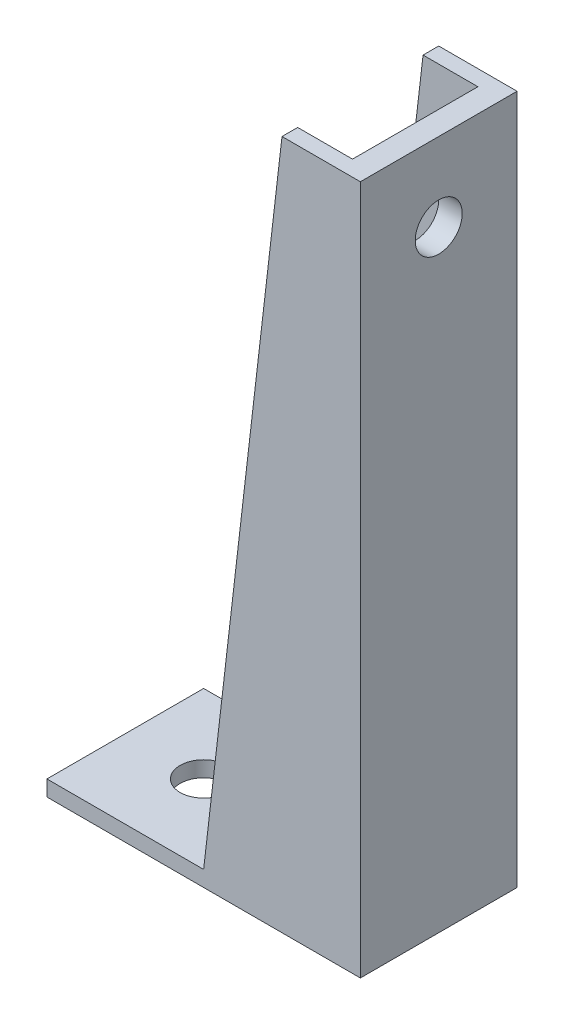
from build123d import *

# Parameters (mm, degrees)
SKETCH1_W           = 40
SKETCH1_H           = 20
BOSS_EXTRUDE1_DEPTH = 2
SKETCH2_R           = 3
CUT_EXTRUDE1_DEPTH  = 2
SKETCH3_W           = 20
SKETCH3_H           = 20
SKETCH3_W_2         = 15
SKETCH3_H_2         = 16
BOSS_EXTRUDE2_DEPTH = 86
SKETCH4_R           = 3
CUT_EXTRUDE2_DEPTH  = 86
CUT_EXTRUDE3_DEPTH  = 86


with BuildPart() as part:
    # Sketch1 → Boss-Extrude1 (new body)
    with BuildSketch(Plane(origin=(0, 0, 0), x_dir=(1, 0, 0), z_dir=(0, 1, 0))):
        with Locations((20, 10)):
            Rectangle(SKETCH1_W, SKETCH1_H)
    extrude(amount=BOSS_EXTRUDE1_DEPTH)

    # Sketch2 → Cut-Extrude1 (cut)
    with BuildSketch(Plane(origin=(0, 2, 0), x_dir=(1, 0, 0), z_dir=(0, 1, 0))):
        with Locations(Location((10, 10, 0), (0, 0, 270))):
            Circle(SKETCH2_R)
    extrude(amount=-CUT_EXTRUDE1_DEPTH, mode=Mode.SUBTRACT)

    # Sketch3 → Boss-Extrude2 (add)
    with BuildSketch(Plane(origin=(0, 2, 0), x_dir=(1, 0, 0), z_dir=(0, 1, 0))):
        with Locations((30, 10)):
            Rectangle(SKETCH3_W, SKETCH3_H)
        with Locations((29.5, 10)):
            Rectangle(SKETCH3_W_2, SKETCH3_H_2, mode=Mode.SUBTRACT)
    extrude(amount=BOSS_EXTRUDE2_DEPTH)

    # Sketch4 → Cut-Extrude2 (cut)
    with BuildSketch(Plane(origin=(40, 0, 0), x_dir=(0, 0, -1), z_dir=(1, 0, 0))):
        with Locations((10, 78)):
            Circle(SKETCH4_R)
    extrude(amount=-CUT_EXTRUDE2_DEPTH, mode=Mode.SUBTRACT)

    # Sketch5 → Cut-Extrude3 (cut)
    with BuildSketch(Plane.XY):
        Polygon((30, 88), (20, 2), (20, 88), align=None)
    extrude(amount=-CUT_EXTRUDE3_DEPTH, mode=Mode.SUBTRACT)


solid = part.part
